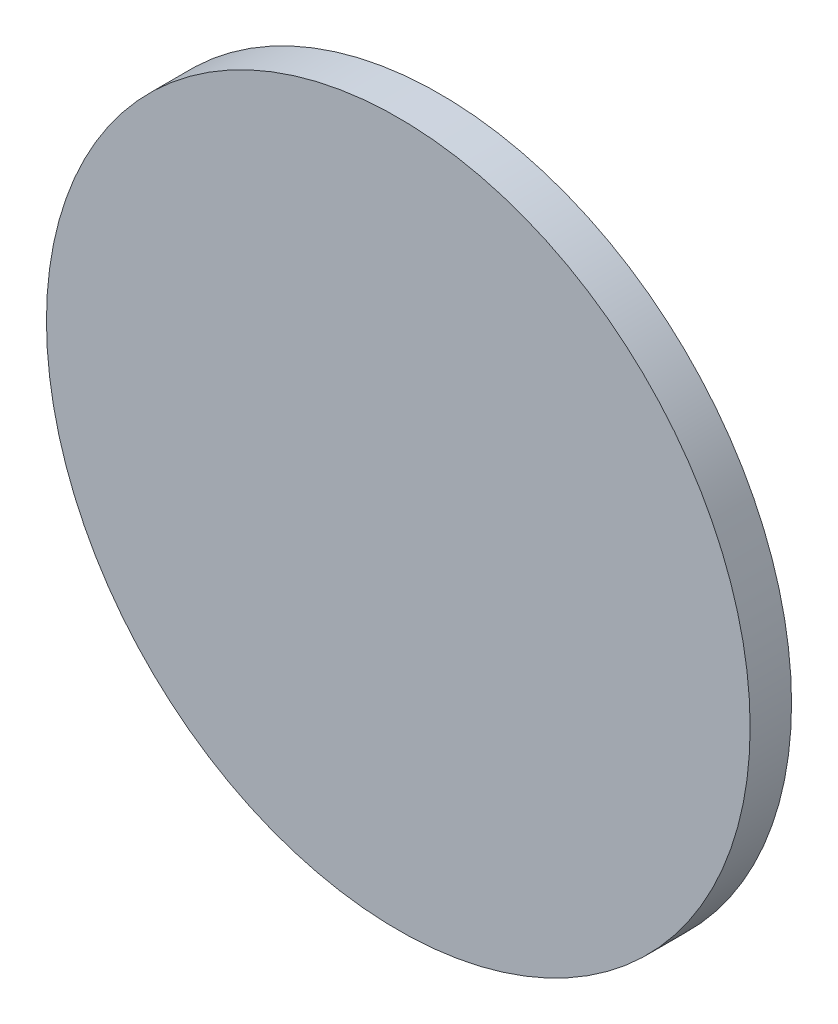
from build123d import *

# Parameters (mm, degrees)
ESQUISSE1_R        = 42.5
BOSS_EXTRU_1_DEPTH = 5


with BuildPart() as part:
    # Esquisse1 → Boss.-Extru.1 (new body)
    with BuildSketch(Plane.XY):
        Circle(ESQUISSE1_R)
    extrude(amount=BOSS_EXTRU_1_DEPTH)


solid = part.part
